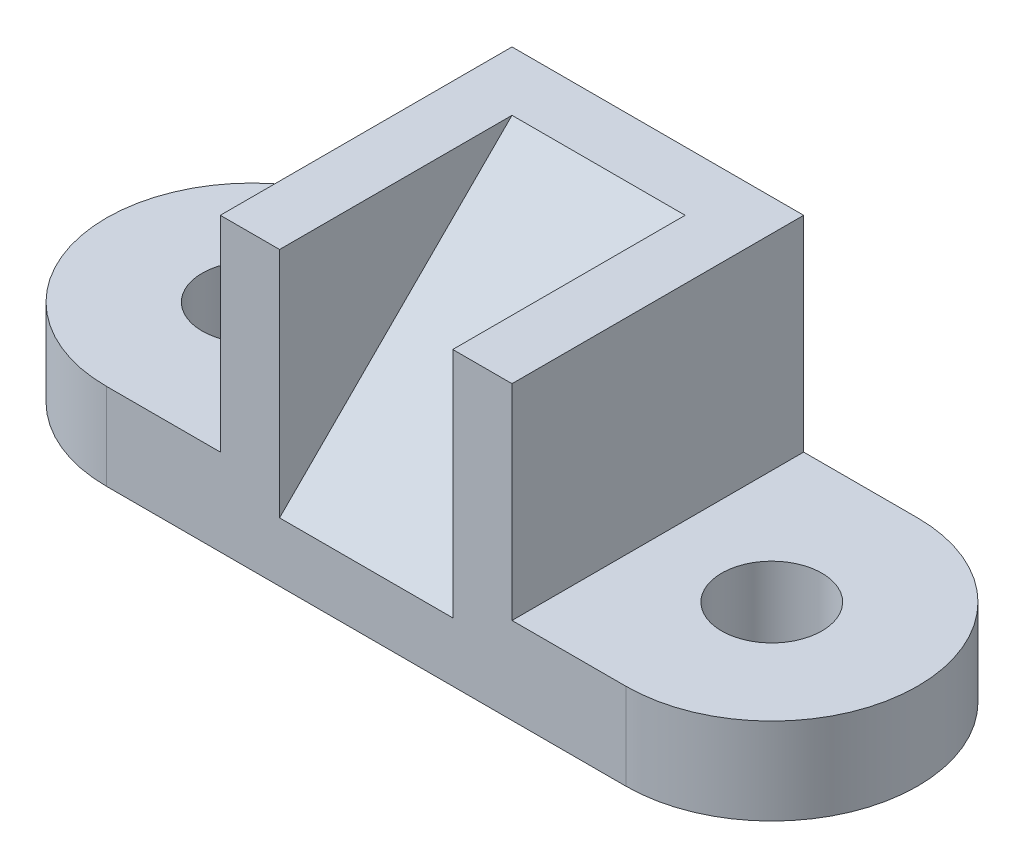
from build123d import *

# Parameters (mm, degrees)
SKETCH2_R           = 11
BOSS_EXTRUDE1_DEPTH = 19
SKETCH3_W           = 64
SKETCH3_H           = 64
BOSS_EXTRUDE2_DEPTH = 45
SKETCH4_W           = 38
SKETCH4_H           = 51
CUT_EXTRUDE1_DEPTH  = 51
BOSS_EXTRUDE3_DEPTH = 38


with BuildPart() as part:
    # Sketch2 → Boss-Extrude1 (new body)
    with BuildSketch(Plane(origin=(0, 0, 0), x_dir=(1, 0, 0), z_dir=(0, 1, 0))):
        with BuildLine():
            Line((-57, 32), (57, 32))
            ThreePointArc((57, 32), (89, 0), (57, -32))
            Line((57, -32), (-57, -32))
            ThreePointArc((-57, -32), (-89, 0), (-57, 32))
        make_face()
        with Locations(Location((-57, 0, 0), (0, 0, 270))):
            Circle(SKETCH2_R, mode=Mode.SUBTRACT)
        with Locations(Location((57, 0, 0), (0, 0, 270))):
            Circle(SKETCH2_R, mode=Mode.SUBTRACT)
    extrude(amount=BOSS_EXTRUDE1_DEPTH)

    # Sketch3 → Boss-Extrude2 (add)
    with BuildSketch(Plane(origin=(0, 19, 0), x_dir=(1, 0, 0), z_dir=(0, 1, 0))):
        Rectangle(SKETCH3_W, SKETCH3_H)
    extrude(amount=BOSS_EXTRUDE2_DEPTH)

    # Sketch4 → Cut-Extrude1 (cut)
    with BuildSketch(Plane(origin=(0, 64, 0), x_dir=(1, 0, 0), z_dir=(0, 1, 0))):
        with Locations((0, -6.5)):
            Rectangle(SKETCH4_W, SKETCH4_H)
    extrude(amount=-CUT_EXTRUDE1_DEPTH, mode=Mode.SUBTRACT)

    # Sketch5 → Boss-Extrude3 (add)
    with BuildSketch(Plane(origin=(-19, 0, 0), x_dir=(0, 0, -1), z_dir=(1, 0, 0))):
        Polygon((-32, 13), (19, 64), (19, 13), align=None)
    extrude(amount=BOSS_EXTRUDE3_DEPTH)


solid = part.part
